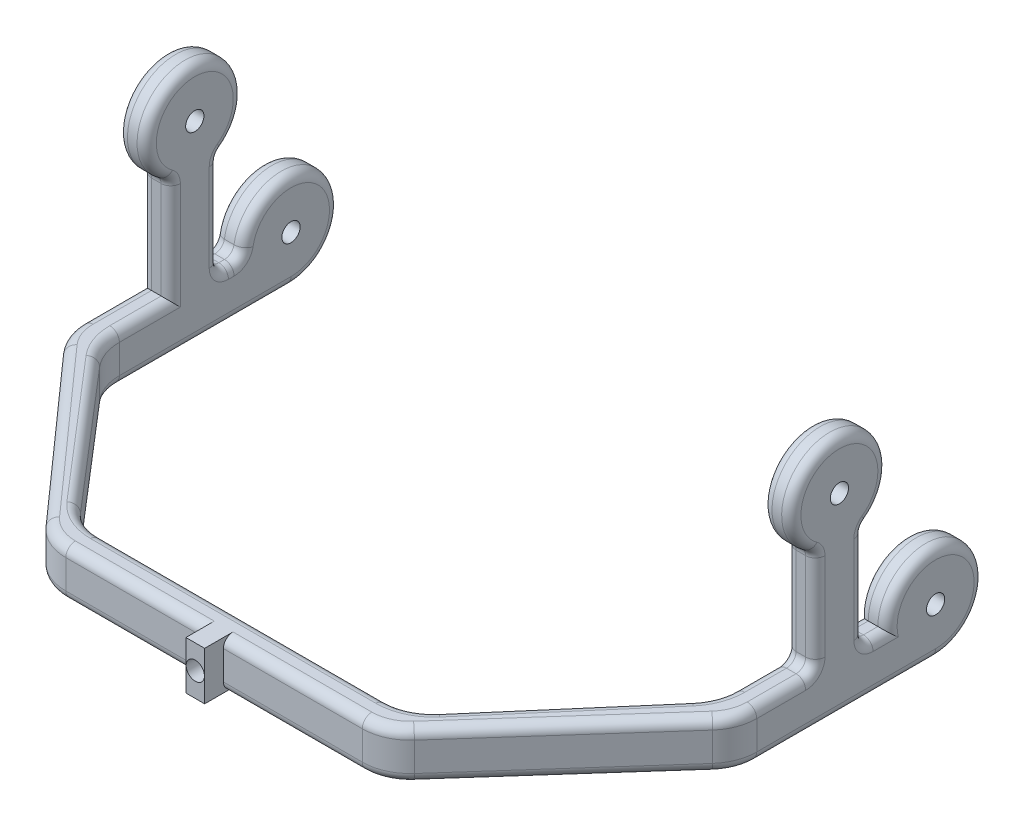
from build123d import *

# Parameters (mm, degrees)
SKETCH1_W                = 36
SKETCH1_H                = 10
BOSS_EXTRUDE1_DEPTH      = 6
BOSS_EXTRUDE2_DEPTH      = 3.8
BOSS_EXTRUDE3_DEPTH      = 10
BOSS_EXTRUDE4_DEPTH      = 3
BOSS_EXTRUDE4_DEPTH_BACK = 3
SKETCH8_W                = 10
SKETCH8_H                = 30
BOSS_EXTRUDE5_DEPTH      = 3
BOSS_EXTRUDE5_DEPTH_BACK = 3
SKETCH12_W               = 10
SKETCH12_H               = 30
SKETCH13_R               = 10
BOSS_EXTRUDE6_DEPTH      = 6
BOSS_EXTRUDE7_START      = -6
SKETCH14_R               = 10
BOSS_EXTRUDE7_DEPTH      = 6
CUT_EXTRUDE2_DEPTH       = 165.429316121
CUT_EXTRUDE2_DEPTH_BACK  = 165.429316121
SKETCH15_R               = 1.9
CUT_EXTRUDE3_DEPTH       = 165.429316121
CUT_EXTRUDE3_DEPTH_BACK  = 165.429316121
SKETCH16_R               = 1.9
FILLET1_R                = 10
FILLET2_R                = 10
SKETCH17_W               = 64.37215868
SKETCH17_H               = 11.062194897
CUT_EXTRUDE4_DEPTH       = 10
SKETCH21_W               = 3.9
SKETCH21_H               = 10
BOSS_EXTRUDE8_DEPTH      = 3.9
CUT_EXTRUDE11_DEPTH      = 119.241278748
CUT_EXTRUDE11_DEPTH_BACK = 119.241278748
SKETCH23_R               = 1.9
FILLET4_R                = 2


with BuildPart() as part:
    # Sketch1 → Boss-Extrude1 (new body)
    with BuildSketch(Plane.XY):
        Rectangle(SKETCH1_W, SKETCH1_H)
    extrude(amount=BOSS_EXTRUDE1_DEPTH)

    # Sketch2 → Boss-Extrude2 (add)
    with BuildSketch(Plane.XY.offset(6)):
        Polygon((-18, -1.9), (-1.9, -1.9), (-1.9, -5), (1.9, -5), (1.9, -1.9), (18, -1.9), (18, 1.9), (1.9, 1.9), (1.9, 5), (-1.9, 5), (-1.9, 1.9), (-18, 1.9), align=None)
    extrude(amount=BOSS_EXTRUDE2_DEPTH)

    # Sketch5 → Boss-Extrude3 (add)
    with BuildSketch(Plane(origin=(0, 5, 0), x_dir=(1, 0, 0), z_dir=(0, 1, 0))):
        Polygon((18, -6), (18, 0), (34.255207255, 0), (64, 34.615121527), (64, 74), (70, 74), (70, 33.020710158), (35.302880567, -6), align=None)
        Polygon((-64, 74), (-64, 34.615121527), (-34.255207255, 0), (-18, 0), (-18, -6), (-35.302880567, -6), (-70, 33.020710158), (-70, 74), align=None)
    extrude(amount=-BOSS_EXTRUDE3_DEPTH)

    # Sketch8 → Boss-Extrude4 (add, two sides: drawn at the far end of the back side and taken through both)
    with BuildSketch(Plane.ZY.offset(-67).offset(-BOSS_EXTRUDE4_DEPTH_BACK)):
        with Locations((-54, 20)):
            Rectangle(SKETCH8_W, SKETCH8_H)
    extrude(amount=BOSS_EXTRUDE4_DEPTH + BOSS_EXTRUDE4_DEPTH_BACK)

    # Sketch12 → Boss-Extrude5 (add, two sides: drawn at the far end of the back side and taken through both)
    with BuildSketch(Plane(origin=(-67, 0, 0), x_dir=(0, 0, -1), z_dir=(1, 0, 0)).offset(-BOSS_EXTRUDE5_DEPTH_BACK)):
        with Locations((54, 20)):
            Rectangle(SKETCH12_W, SKETCH12_H)
    extrude(amount=BOSS_EXTRUDE5_DEPTH + BOSS_EXTRUDE5_DEPTH_BACK)

    # Sketch13 → Boss-Extrude6 (add)
    with BuildSketch(Plane.ZY.offset(-64)):
        with Locations((-74, 5)):
            Circle(SKETCH13_R)
        with Locations((-54, 35)):
            Circle(SKETCH13_R)
    extrude(amount=-BOSS_EXTRUDE6_DEPTH)

    # Sketch14 → Boss-Extrude7 (add)
    with BuildSketch(Plane(origin=(-64, 0, 0), x_dir=(0, 0, -1), z_dir=(1, 0, 0)).offset(BOSS_EXTRUDE7_START)):
        with Locations((74, 5)):
            Circle(SKETCH14_R)
        with Locations((54, 35)):
            Circle(SKETCH14_R)
    extrude(amount=BOSS_EXTRUDE7_DEPTH)

    # Sketch15 → Cut-Extrude2 (cut, two sides: drawn at the far end of the back side and taken through both)
    with BuildSketch(Plane(origin=(-64, 0, 0), x_dir=(0, 0, -1), z_dir=(1, 0, 0)).offset(-CUT_EXTRUDE2_DEPTH_BACK)):
        with Locations((54, 35)):
            Circle(SKETCH15_R)
    extrude(amount=CUT_EXTRUDE2_DEPTH + CUT_EXTRUDE2_DEPTH_BACK, mode=Mode.SUBTRACT)

    # Sketch16 → Cut-Extrude3 (cut, two sides: drawn at the far end of the back side and taken through both)
    with BuildSketch(Plane(origin=(-64, 0, 0), x_dir=(0, 0, -1), z_dir=(1, 0, 0)).offset(-CUT_EXTRUDE3_DEPTH_BACK)):
        with Locations((74, 5)):
            Circle(SKETCH16_R)
    extrude(amount=CUT_EXTRUDE3_DEPTH + CUT_EXTRUDE3_DEPTH_BACK, mode=Mode.SUBTRACT)

    # Fillet1
    fillet1_edges = [part.edges().sort_by_distance(p)[0] for p in [
        (64, 0, -34.615121527),
        (34.255207255, 0, 0),
        (-34.255207255, 0, 0),
        (-64, 0, -34.615121527),
    ]]
    fillet(fillet1_edges, radius=FILLET1_R)

    # Fillet2
    fillet2_edges = [part.edges().sort_by_distance(p)[0] for p in [
        (-70, 0, -33.020710158),
        (70, 0, -33.020710158),
        (35.302880567, 0, 6),
        (-35.302880567, 0, 6),
    ]]
    fillet(fillet2_edges, radius=FILLET2_R)

    # Sketch17 → Cut-Extrude4 (cut)
    with BuildSketch(Plane(origin=(0, 5, 0), x_dir=(1, 0, 0), z_dir=(0, 1, 0))):
        with Locations((1.372823675, -11.531097449)):
            Rectangle(SKETCH17_W, SKETCH17_H)
    extrude(amount=-CUT_EXTRUDE4_DEPTH, mode=Mode.SUBTRACT)

    # Sketch21 → Boss-Extrude8 (add)
    with BuildSketch(Plane.XY.offset(6)):
        Rectangle(SKETCH21_W, SKETCH21_H)
    extrude(amount=BOSS_EXTRUDE8_DEPTH)

    # Sketch23 → Cut-Extrude11 (cut, two sides: drawn at the far end of the back side and taken through both)
    with BuildSketch(Plane(origin=(0, 0, 0), x_dir=(-1, 0, 0), z_dir=(0, 0, -1)).offset(-CUT_EXTRUDE11_DEPTH_BACK)):
        Circle(SKETCH23_R)
    extrude(amount=CUT_EXTRUDE11_DEPTH + CUT_EXTRUDE11_DEPTH_BACK, mode=Mode.SUBTRACT)

    # Fillet4
    fillet4_edges = [part.edges().sort_by_distance(p)[0] for p in [
        (-70, 15.669872981, -49),
        (-64, 15.669872981, -49),
        (-70, 15.669872981, -59),
        (-64, 15.669872981, -59),
        (70, 5, -61.5),
        (64, 5, -61.5),
        (64, 12.071067812, -81.071067812),
        (64, -5, -56.160713328),
        (63.376692905, -5, -34.846138155),
        (49.416165308, -5, -17.643370723),
        (33.836305753, -5, -0.912276797),
        (0, -5, 0),
        (-33.836305753, -5, -0.912276797),
        (-64, 12.071067812, -81.071067812),
        (-64, -5, -56.160713328),
        (-63.376692905, -5, -34.846138155),
        (63.376692905, 5, -34.846138155),
        (49.416165308, 5, -17.643370723),
        (33.836305753, 5, -0.912276797),
        (-64, 5, -43.660713328),
        (-63.376692905, 5, -34.846138155),
        (-49.416165308, 5, -17.643370723),
        (-33.836305753, 5, -0.912276797),
        (70, 12.071067812, -81.071067812),
        (70, -5, -55.411844985),
        (69.346910657, -5, -33.269078717),
        (52.8795756, -5, -13.766918223),
        (34.909029852, -5, 5.122753631),
        (-70, 12.071067812, -81.071067812),
        (-70, -5, -55.411844985),
        (-69.346910657, -5, -33.269078717),
        (-52.8795756, -5, -13.766918223),
        (-34.909029852, -5, 5.122753631),
        (-70, 5, -42.911844985),
        (-69.346910657, 5, -33.269078717),
        (-52.8795756, 5, -13.766918223),
        (-34.909029852, 5, 5.122753631),
        (69.346910657, 5, -33.269078717),
        (52.8795756, 5, -13.766918223),
        (34.909029852, 5, 5.122753631),
        (-67, 26.339745962, -49),
        (-70, 45, -54),
        (-67, 26.339745962, -59),
        (-64, 45, -54),
        (-67, 5, -59),
        (-70, 5, -61.5),
        (-67, 5, -64),
        (-64, 5, -61.5),
        (67, 5, -59),
        (70, 15.669872981, -59),
        (67, 26.339745962, -59),
        (64, 15.669872981, -59),
        (70, 15.669872981, -49),
        (67, 5, -49),
        (64, 15.669872981, -49),
        (67, 26.339745962, -49),
        (64, 45, -54),
        (70, 45, -54),
        (-49.416165308, -5, -17.643370723),
        (0, 5, 0),
        (-16.381627833, -5, 6),
        (-16.381627833, 5, 6),
    ]]
    fillet(fillet4_edges, radius=FILLET4_R)


solid = part.part
